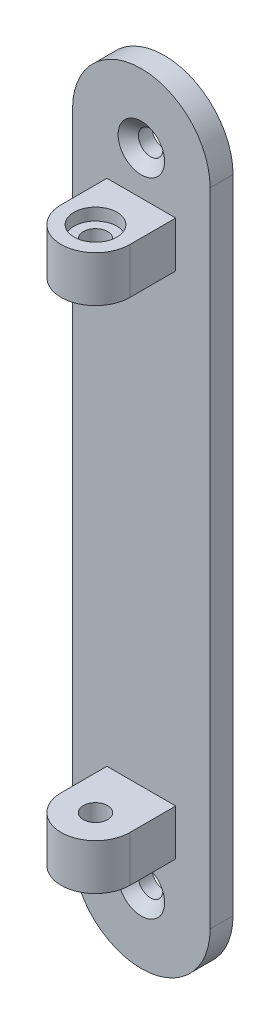
from build123d import *

# Parameters (mm, degrees)
BOSS_EXTRUDE1_DEPTH                                 = 6.35
CSK_FOR_1_4_FLAT_HEAD_MACHINE_SCREW_100_D           = 6.7564
CSK_FOR_1_4_FLAT_HEAD_MACHINE_SCREW_100_CSINK_D     = 12.8778
CSK_FOR_1_4_FLAT_HEAD_MACHINE_SCREW_100_CSINK_ANGLE = 100
SKETCH6_W                                           = 19.05
SKETCH6_H                                           = 12.7
BOSS_EXTRUDE2_DEPTH                                 = 12.7
BOSS_EXTRUDE3_DEPTH                                 = 12.7
CBORE_FOR_1_4_BUTTON_HEAD_CAP_SCREW1_D              = 6.7564
CBORE_FOR_1_4_BUTTON_HEAD_CAP_SCREW1_CBORE_D        = 11.90752
CBORE_FOR_1_4_BUTTON_HEAD_CAP_SCREW1_CBORE_DEPTH    = 3.3528


with BuildPart() as part:
    # Sketch1 → Boss-Extrude1 (new body)
    with BuildSketch(Plane.XY):
        with BuildLine():
            Line((0, 0), (0, 88.9))
            ThreePointArc((0, 88.9), (19.05, 107.95), (38.1, 88.9))
            Line((38.1, 88.9), (38.1, 0))
            Line((38.1, 0), (0, 0))
        make_face()
    extrude(amount=BOSS_EXTRUDE1_DEPTH)

    # CSK for 1/4 Flat Head Machine Screw (100)1 (through all)
    with Locations(Plane.XY.offset(6.35)):
        with Locations((19.05, 88.9)):
            CounterSinkHole(CSK_FOR_1_4_FLAT_HEAD_MACHINE_SCREW_100_D / 2, CSK_FOR_1_4_FLAT_HEAD_MACHINE_SCREW_100_CSINK_D / 2, counter_sink_angle=CSK_FOR_1_4_FLAT_HEAD_MACHINE_SCREW_100_CSINK_ANGLE)

    # Sketch6 → Boss-Extrude2 (add)
    with BuildSketch(Plane.XY.offset(6.35)):
        with Locations((19.05, 70.519259932)):
            Rectangle(SKETCH6_W, SKETCH6_H)
    extrude(amount=BOSS_EXTRUDE2_DEPTH)

    # Sketch10 → Boss-Extrude3 (add)
    with BuildSketch(Plane(origin=(0, 76.869259932, 0), x_dir=(1, 0, 0), z_dir=(0, 1, 0))):
        with BuildLine():
            Line((9.525, -19.05), (28.575, -19.05))
            ThreePointArc((28.575, -19.05), (19.05, -28.575), (9.525, -19.05))
        make_face()
    extrude(amount=-BOSS_EXTRUDE3_DEPTH)

    # CBORE for 1/4 Button Head Cap Screw1 (through all)
    with Locations(Plane(origin=(0, 76.869259932, 0), x_dir=(1, 0, 0), z_dir=(0, 1, 0))):
        with Locations((19.05, -19.05)):
            CounterBoreHole(CBORE_FOR_1_4_BUTTON_HEAD_CAP_SCREW1_D / 2, CBORE_FOR_1_4_BUTTON_HEAD_CAP_SCREW1_CBORE_D / 2, CBORE_FOR_1_4_BUTTON_HEAD_CAP_SCREW1_CBORE_DEPTH)

    # Mirror1: part across plane


with BuildPart() as part_1:
    add(part.part)
    add(part.part.mirror(Plane(origin=(0, 0, 6.35), x_dir=(0, 0, 1), z_dir=(0, 1, 0))))


solid = part_1.part
